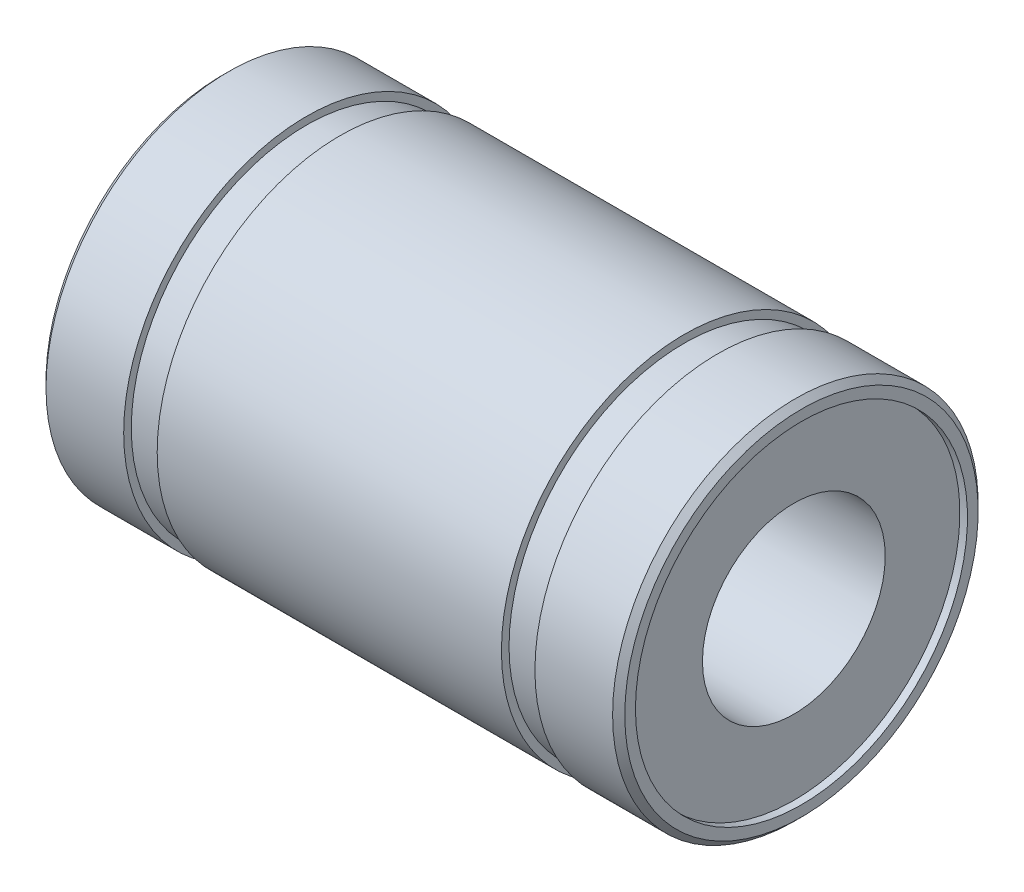
from build123d import *

# Parameters (mm, degrees)
CHAMFER1_SIZE = 0.2


with BuildPart() as part:
    # Sketch1 → Revolve1 (revolve)
    with BuildSketch(Plane.XY, mode=Mode.PRIVATE) as revolve1_sk:
        Polygon((0.25, 3), (0.25, 5.45), (0, 5.45), (0, 6), (2.75, 6), (2.75, 5.75), (3.85, 5.75), (3.85, 6), (15.15, 6), (15.15, 5.75), (16.25, 5.75), (16.25, 6), (19, 6), (19, 5.45), (18.75, 5.45), (18.75, 3), align=None)
    revolve(revolve1_sk.sketch.rotate(Axis((0, 0, 0), (1, 0, 0)), 90), axis=Axis((0, 0, 0), (1, 0, 0)))

    # Chamfer1
    chamfer1_edges = [part.edges().sort_by_distance(p)[0] for p in [
        (19, 0, -6),
        (0, 0, -6),
    ]]
    chamfer(chamfer1_edges, length=CHAMFER1_SIZE)


solid = part.part
